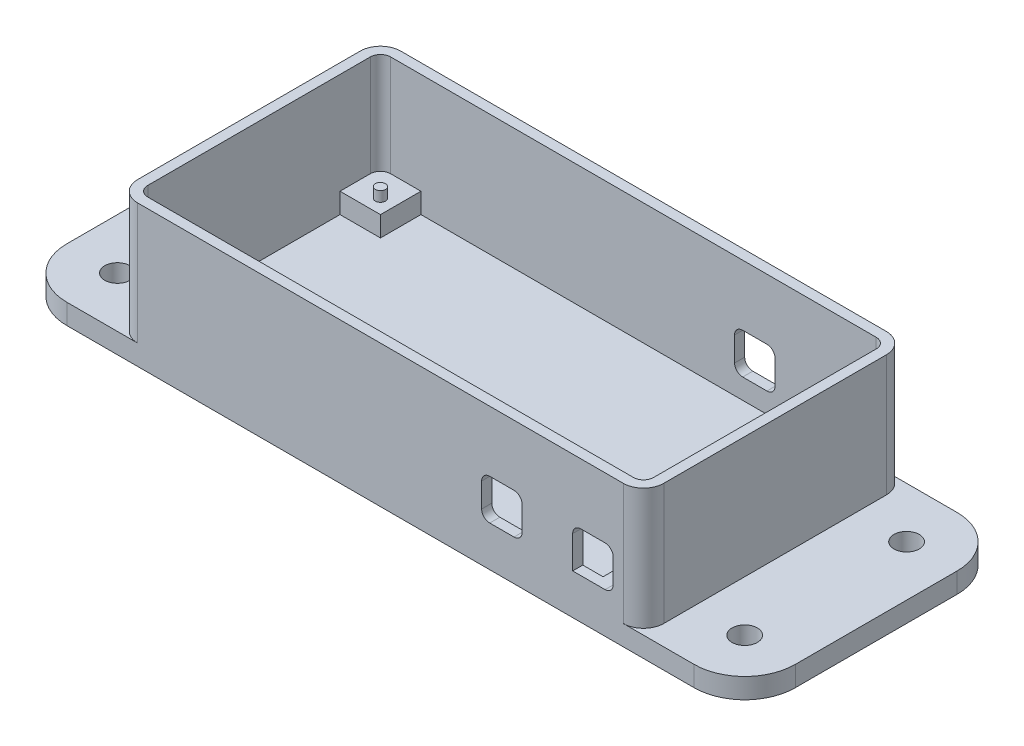
from build123d import *

# Parameters (mm, degrees)
SKETCH1_W                      = 182.88
SKETCH1_H                      = 66.04
BOSS_EXTRUDE2_DEPTH            = 5.08
FILLET2_R                      = 12.7
CUT_EXTRUDE1_DEPTH             = 195.504967546
CUT_EXTRUDE1_DEPTH_BACK        = 195.504967546
SKETCH3_R                      = 3.175
BOSS_EXTRUDE6_DEPTH            = 30.48
SKETCH7_W                      = 10.16
SKETCH7_H                      = 10.16
BOSS_EXTRUDE8_DEPTH            = 5.08
SKETCH10_R                     = 1.27
BOSS_EXTRUDE10_DEPTH           = 2.54
CUT_EXTRUDE4_REACH             = 199.664
SKETCH12_W                     = 10.16
SKETCH12_H                     = 10.16
CUT_EXTRUDE4_DIRECTION_2_DEPTH = 198.663576817
CUT_EXTRUDE5_REACH             = 199.664
SKETCH14_W                     = 10.16
SKETCH14_H                     = 10.16
FILLET5_R                      = 2.032
FILLET6_R                      = 5.08
FILLET7_R                      = 2.54


with BuildPart() as part:
    # Sketch1 → Boss-Extrude2 (new body)
    with BuildSketch(Plane(origin=(0, 0, 0), x_dir=(1, 0, 0), z_dir=(0, 1, 0))):
        with Locations((-91.44, 33.02)):
            Rectangle(SKETCH1_W, SKETCH1_H)
    extrude(amount=BOSS_EXTRUDE2_DEPTH)

    # Fillet2
    fillet2_edges = [part.edges().sort_by_distance(p)[0] for p in [
        (0, 2.54, 0),
        (-182.88, 2.54, 0),
        (-182.88, 2.54, -66.04),
        (0, 2.54, -66.04),
    ]]
    fillet(fillet2_edges, radius=FILLET2_R)

    # Sketch3 → Cut-Extrude1 (cut, two sides: drawn at the far end of the back side and taken through both)
    with BuildSketch(Plane(origin=(0, 5.08, 0), x_dir=(1, 0, 0), z_dir=(0, 1, 0)).offset(-CUT_EXTRUDE1_DEPTH_BACK)):
        with Locations(Location((-12.7, 12.7, 0), (0, 0, 270))):
            Circle(SKETCH3_R)
        with Locations(Location((-12.7, 53.34, 0), (0, 0, 270))):
            Circle(SKETCH3_R)
        with Locations(Location((-170.18, 53.34, 0), (0, 0, 270))):
            Circle(SKETCH3_R)
        with Locations(Location((-170.18, 12.7, 0), (0, 0, 270))):
            Circle(SKETCH3_R)
    extrude(amount=CUT_EXTRUDE1_DEPTH + CUT_EXTRUDE1_DEPTH_BACK, mode=Mode.SUBTRACT)

    # Sketch4 → Boss-Extrude6 (add)
    with BuildSketch(Plane(origin=(0, 5.08, 0), x_dir=(1, 0, 0), z_dir=(0, 1, 0))):
        Polygon((-157.48, 0), (-30.606358486, 0), (-25.4, 0), (-25.4, 66.04), (-157.48, 66.04), align=None)
        Polygon((-27.94, 55.88), (-27.94, 10.16), (-27.94, 2.54), (-35.56, 2.54), (-147.32, 2.54), (-154.94, 2.54), (-154.94, 10.16), (-154.94, 55.88), (-154.94, 63.5), (-147.32, 63.5), (-35.56, 63.5), (-27.94, 63.5), align=None, mode=Mode.SUBTRACT)
    extrude(amount=BOSS_EXTRUDE6_DEPTH)

    # Sketch7 → Boss-Extrude8 (add)
    with BuildSketch(Plane(origin=(0, 5.08, 0), x_dir=(1, 0, 0), z_dir=(0, 1, 0))):
        with Locations((-33.02, 7.62)):
            Rectangle(SKETCH7_W, SKETCH7_H)
        with Locations((-149.86, 7.62)):
            Rectangle(SKETCH7_W, SKETCH7_H)
        with Locations((-149.86, 58.42)):
            Rectangle(SKETCH7_W, SKETCH7_H)
        with Locations((-33.02, 58.42)):
            Rectangle(SKETCH7_W, SKETCH7_H)
    extrude(amount=BOSS_EXTRUDE8_DEPTH)

    # Sketch10 → Boss-Extrude10 (add)
    with BuildSketch(Plane(origin=(0, 10.16, 0), x_dir=(1, 0, 0), z_dir=(0, 1, 0))):
        with Locations(Location((-34.544, 9.144, 0), (0, 0, 270))):
            Circle(SKETCH10_R)
        with Locations(Location((-148.336, 9.144, 0), (0, 0, 270))):
            Circle(SKETCH10_R)
        with Locations(Location((-148.336, 56.896, 0), (0, 0, 270))):
            Circle(SKETCH10_R)
        with Locations(Location((-34.544, 56.896, 0), (0, 0, 270))):
            Circle(SKETCH10_R)
    extrude(amount=BOSS_EXTRUDE10_DEPTH)

    # Sketch12 → Cut-Extrude4 (cut, up to next)
    with BuildSketch(Plane(origin=(0, 0, -66.04), x_dir=(-1, 0, 0), z_dir=(0, 0, -1)), mode=Mode.PRIVATE) as cut_extrude4_sk1:
        with Locations((38.1, 15.24)):
            Rectangle(SKETCH12_W, SKETCH12_H)
    cut_extrude4_tool1 = extrude(cut_extrude4_sk1.sketch, amount=-CUT_EXTRUDE4_REACH, mode=Mode.PRIVATE) & part.part
    # Sketch12 → Cut-Extrude4 (cut, up to next)
    with BuildSketch(Plane(origin=(0, 0, -66.04), x_dir=(-1, 0, 0), z_dir=(0, 0, -1)), mode=Mode.PRIVATE) as cut_extrude4_sk2:
        with Locations((60.96, 15.24)):
            Rectangle(SKETCH12_W, SKETCH12_H)
    cut_extrude4_tool2 = extrude(cut_extrude4_sk2.sketch, amount=-CUT_EXTRUDE4_REACH, mode=Mode.PRIVATE) & part.part
    add(cut_extrude4_tool1.solids().sort_by_distance((-38.1, 15.24, -66.04))[0], mode=Mode.SUBTRACT)
    add(cut_extrude4_tool2.solids().sort_by_distance((-60.96, 15.24, -66.04))[0], mode=Mode.SUBTRACT)

    # Sketch12 → Cut-Extrude4 direction 2 (cut)
    with BuildSketch(Plane(origin=(0, 0, -66.04), x_dir=(-1, 0, 0), z_dir=(0, 0, -1))):
        with Locations((38.1, 15.24)):
            Rectangle(SKETCH12_W, SKETCH12_H)
        with Locations((60.96, 15.24)):
            Rectangle(SKETCH12_W, SKETCH12_H)
    extrude(amount=CUT_EXTRUDE4_DIRECTION_2_DEPTH, mode=Mode.SUBTRACT)

    # Sketch14 → Cut-Extrude5 (cut, up to next)
    with BuildSketch(Plane.XY, mode=Mode.PRIVATE) as cut_extrude5_sk1:
        with Locations((-38.1, 15.24)):
            Rectangle(SKETCH14_W, SKETCH14_H)
    cut_extrude5_tool1 = extrude(cut_extrude5_sk1.sketch, amount=-CUT_EXTRUDE5_REACH, mode=Mode.PRIVATE) & part.part
    # Sketch14 → Cut-Extrude5 (cut, up to next)
    with BuildSketch(Plane.XY, mode=Mode.PRIVATE) as cut_extrude5_sk2:
        with Locations((-60.96, 15.24)):
            Rectangle(SKETCH14_W, SKETCH14_H)
    cut_extrude5_tool2 = extrude(cut_extrude5_sk2.sketch, amount=-CUT_EXTRUDE5_REACH, mode=Mode.PRIVATE) & part.part
    add(cut_extrude5_tool1.solids().sort_by_distance((-38.1, 15.24, 0))[0], mode=Mode.SUBTRACT)
    add(cut_extrude5_tool2.solids().sort_by_distance((-60.96, 15.24, 0))[0], mode=Mode.SUBTRACT)

    # Fillet5
    fillet5_edges = [part.edges().sort_by_distance(p)[0] for p in [
        (-33.02, 20.32, -64.77),
        (-33.02, 10.16, -64.77),
        (-43.18, 10.16, -64.77),
        (-43.18, 20.32, -64.77),
        (-55.88, 20.32, -64.77),
        (-55.88, 10.16, -64.77),
        (-66.04, 10.16, -64.77),
        (-66.04, 20.32, -64.77),
        (-43.18, 20.32, -1.27),
        (-33.02, 20.32, -1.27),
        (-33.02, 10.16, -1.27),
        (-66.04, 10.16, -1.27),
        (-66.04, 20.32, -1.27),
        (-55.88, 20.32, -1.27),
        (-55.88, 10.16, -1.27),
    ]]
    fillet(fillet5_edges, radius=FILLET5_R)

    # Fillet6
    fillet6_edges = [part.edges().sort_by_distance(p)[0] for p in [
        (-157.48, 20.32, -66.04),
        (-157.48, 20.32, 0),
        (-25.4, 20.32, 0),
        (-25.4, 20.32, -66.04),
    ]]
    fillet(fillet6_edges, radius=FILLET6_R)

    # Fillet7
    fillet7_edges = [part.edges().sort_by_distance(p)[0] for p in [
        (-27.94, 22.86, -2.54),
        (-154.94, 22.86, -2.54),
        (-154.94, 22.86, -63.5),
        (-27.94, 22.86, -63.5),
    ]]
    fillet(fillet7_edges, radius=FILLET7_R)


solid = part.part
